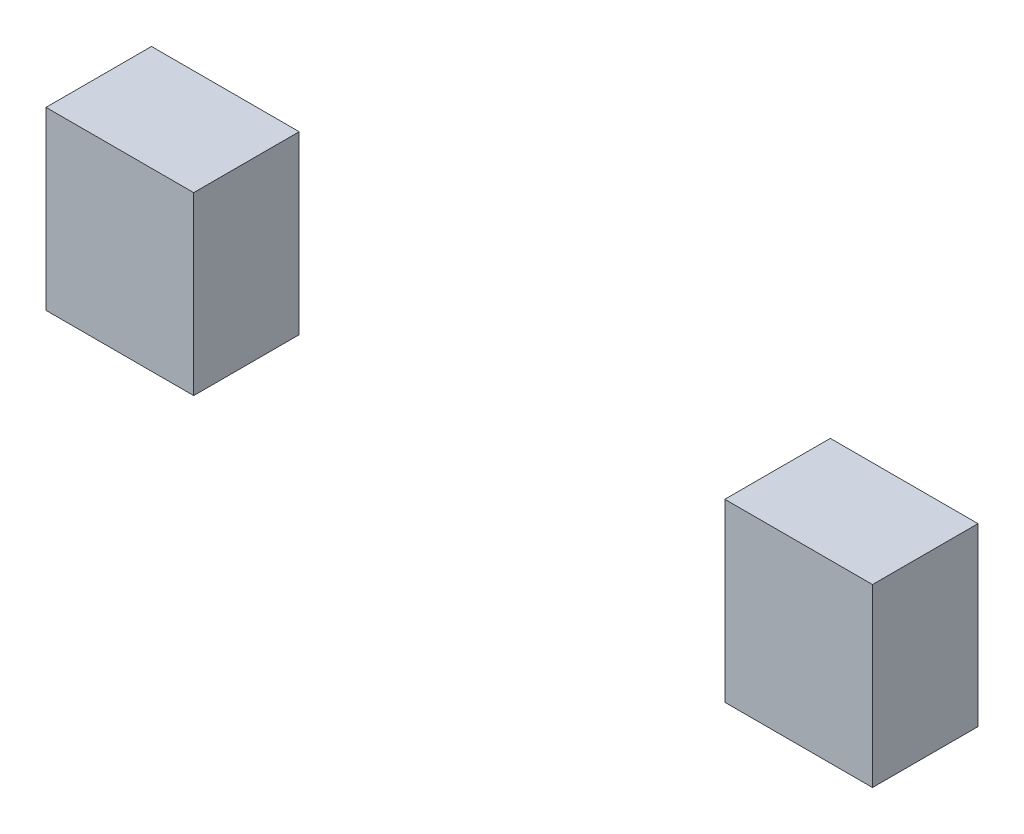
from build123d import *

# Parameters (mm, degrees)
QT_CONNECTOR_1_START     = -22.55
QT_CONNECTOR_1_PROFILE_W = 4.2
QT_CONNECTOR_1_PROFILE_H = 5
QT_CONNECTOR_1_DEPTH     = 3
QT_CONNECTOR_2_START     = -22.55
QT_CONNECTOR_2_PROFILE_W = 4.2
QT_CONNECTOR_2_PROFILE_H = 5
QT_CONNECTOR_2_DEPTH     = 3


with BuildPart() as part:
    # QT_connector_1_Profile → QT_connector_1 (new body)
    with BuildSketch(Plane.XY.offset(QT_CONNECTOR_1_START)):
        with Locations((2.848, 0)):
            Rectangle(QT_CONNECTOR_1_PROFILE_W, QT_CONNECTOR_1_PROFILE_H)
    extrude(amount=QT_CONNECTOR_1_DEPTH)


with BuildPart() as body_2:
    # QT_connector_2_Profile → QT_connector_2 (new body)
    with BuildSketch(Plane.XY.offset(QT_CONNECTOR_2_START)):
        with Locations((22.152, 0)):
            Rectangle(QT_CONNECTOR_2_PROFILE_W, QT_CONNECTOR_2_PROFILE_H)
    extrude(amount=QT_CONNECTOR_2_DEPTH)


solid = Compound([part.part, body_2.part])
